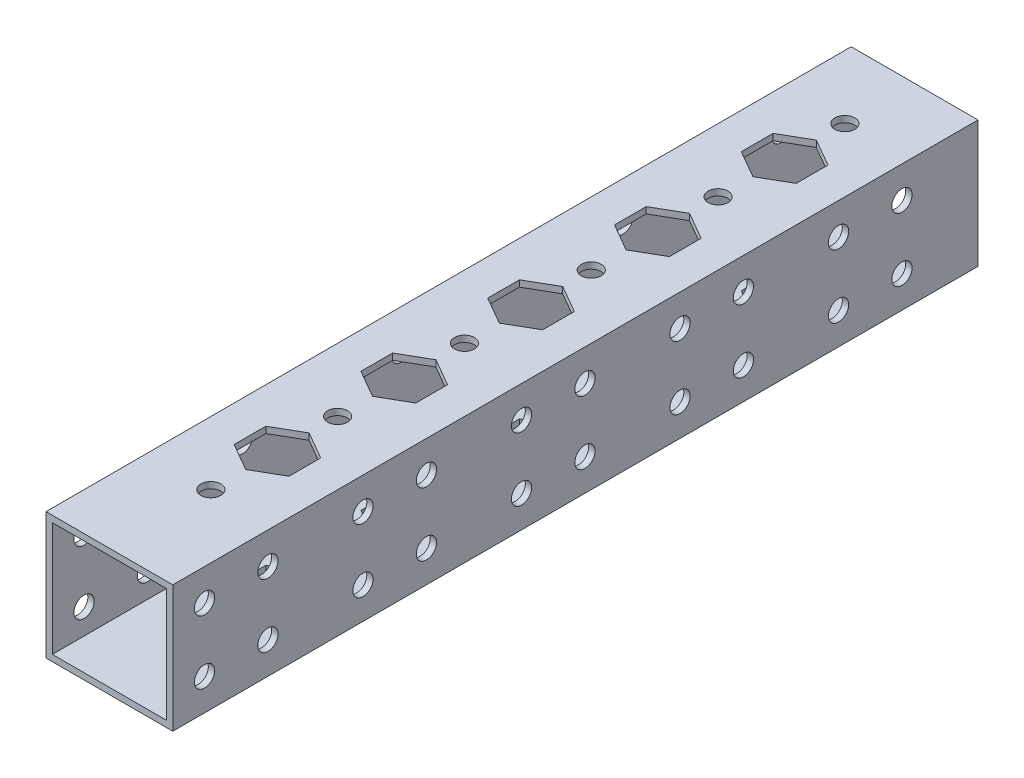
from build123d import *

# Parameters (mm, degrees)
SKETCH_1_W          = 20
SKETCH_1_H          = 20
SKETCH_1_W_2        = 18
SKETCH_1_H_2        = 18
EXTRUDE_1_DEPTH     = 127
SKETCH_2_R          = 1.575
CUT_EXTRUDE_1_DEPTH = 131.111490653
SKETCH_3_R          = 1.6
CUT_EXTRUDE_2_DEPTH = 131.111490653


with BuildPart() as part:
    # 草图1 → 拉伸-薄壁1 (new body)
    with BuildSketch(Plane.XY):
        with Locations((10, -10)):
            Rectangle(SKETCH_1_W, SKETCH_1_H)
        with Locations((10, -10)):
            Rectangle(SKETCH_1_W_2, SKETCH_1_H_2, mode=Mode.SUBTRACT)
    extrude(amount=EXTRUDE_1_DEPTH)

    # 草图2 → 切除-拉伸1 (cut, through all)
    with BuildSketch(Plane.XZ.offset(20)):
        with Locations(Location((10, 11, 0), (0, 0, 270))):
            Circle(SKETCH_2_R)
        with Locations(Location((10, 31, 0), (0, 0, 270))):
            Circle(SKETCH_2_R)
        with Locations(Location((10, 51, 0), (0, 0, 270))):
            Circle(SKETCH_2_R)
        with Locations(Location((10, 71, 0), (0, 0, 270))):
            Circle(SKETCH_2_R)
        with Locations(Location((10, 91, 0), (0, 0, 270))):
            Circle(SKETCH_2_R)
        with Locations(Location((10, 111, 0), (0, 0, 270))):
            Circle(SKETCH_2_R)
        Polygon((10, 45.5), (5.669872981, 43), (5.669872981, 38), (10, 35.5), (14.330127019, 38), (14.330127019, 43), align=None)
        Polygon((10, 25.5), (5.669872981, 23), (5.669872981, 18), (10, 15.5), (14.330127019, 18), (14.330127019, 23), align=None)
        Polygon((10, 65.5), (5.669872981, 63), (5.669872981, 58), (10, 55.5), (14.330127019, 58), (14.330127019, 63), align=None)
        Polygon((10, 85.5), (5.669872981, 83), (5.669872981, 78), (10, 75.5), (14.330127019, 78), (14.330127019, 83), align=None)
        Polygon((10, 105.5), (5.669872981, 103), (5.669872981, 98), (10, 95.5), (14.330127019, 98), (14.330127019, 103), align=None)
    extrude(amount=-CUT_EXTRUDE_1_DEPTH, mode=Mode.SUBTRACT)

    # 草图3 → 切除-拉伸2 (cut, through all)
    with BuildSketch(Plane.ZY):
        with Locations(Location((122, -5, 0), (0, 0, 270))):
            Circle(SKETCH_3_R)
        with Locations(Location((122, -15, 0), (0, 0, 270))):
            Circle(SKETCH_3_R)
        with Locations(Location((112, -15, 0), (0, 0, 270))):
            Circle(SKETCH_3_R)
        with Locations(Location((112, -5, 0), (0, 0, 270))):
            Circle(SKETCH_3_R)
        with Locations(Location((97, -5, 0), (0, 0, 270))):
            Circle(SKETCH_3_R)
        with Locations(Location((97, -15, 0), (0, 0, 270))):
            Circle(SKETCH_3_R)
        with Locations(Location((87, -15, 0), (0, 0, 270))):
            Circle(SKETCH_3_R)
        with Locations(Location((87, -5, 0), (0, 0, 270))):
            Circle(SKETCH_3_R)
        with Locations(Location((72, -5, 0), (0, 0, 270))):
            Circle(SKETCH_3_R)
        with Locations(Location((72, -15, 0), (0, 0, 270))):
            Circle(SKETCH_3_R)
        with Locations(Location((62, -15, 0), (0, 0, 270))):
            Circle(SKETCH_3_R)
        with Locations(Location((62, -5, 0), (0, 0, 270))):
            Circle(SKETCH_3_R)
        with Locations(Location((47, -5, 0), (0, 0, 270))):
            Circle(SKETCH_3_R)
        with Locations(Location((47, -15, 0), (0, 0, 270))):
            Circle(SKETCH_3_R)
        with Locations(Location((37, -15, 0), (0, 0, 270))):
            Circle(SKETCH_3_R)
        with Locations(Location((37, -5, 0), (0, 0, 270))):
            Circle(SKETCH_3_R)
        with Locations(Location((22, -5, 0), (0, 0, 270))):
            Circle(SKETCH_3_R)
        with Locations(Location((22, -15, 0), (0, 0, 270))):
            Circle(SKETCH_3_R)
        with Locations(Location((12, -15, 0), (0, 0, 270))):
            Circle(SKETCH_3_R)
        with Locations(Location((12, -5, 0), (0, 0, 270))):
            Circle(SKETCH_3_R)
    extrude(amount=-CUT_EXTRUDE_2_DEPTH, mode=Mode.SUBTRACT)


solid = part.part
